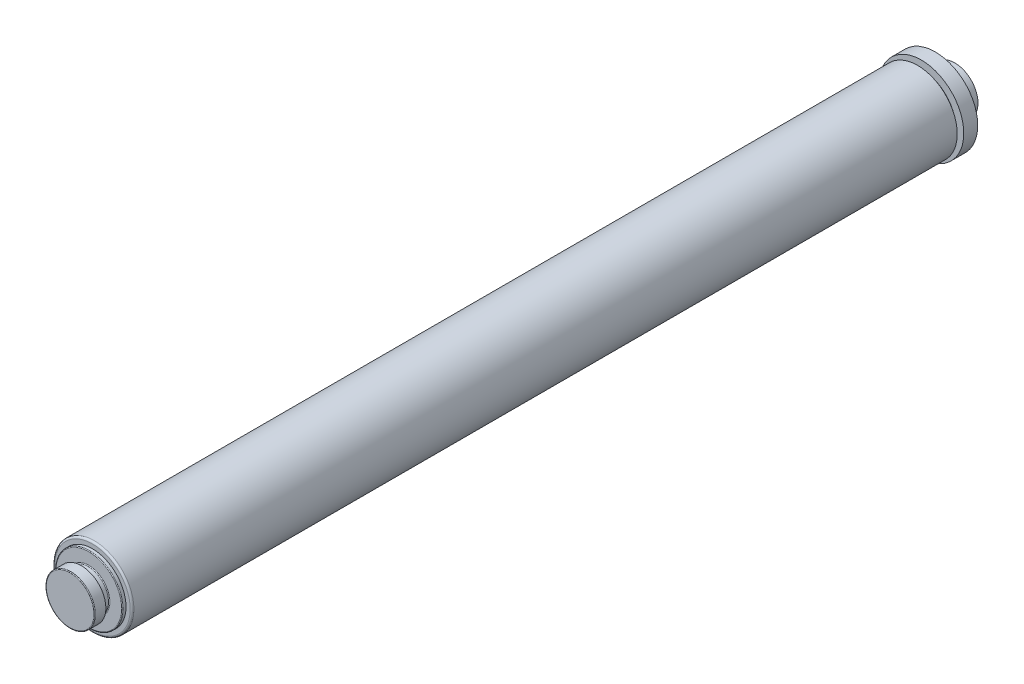
from build123d import *

# Parameters (mm, degrees)
SKETCH1_R           = 26.9875
BOSS_EXTRUDE1_DEPTH = 562.356
SKETCH2_R           = 22.86
BOSS_EXTRUDE2_DEPTH = 2.54
SKETCH3_R           = 13.915766971
BOSS_EXTRUDE3_DEPTH = 5.08
SKETCH4_R           = 16.731786723
BOSS_EXTRUDE4_DEPTH = 7.62
FILLET1_R           = 0.508
FILLET2_R           = 0.508
FILLET3_R           = 0.508
FILLET4_R           = 1.27
SKETCH5_R           = 23.627835933
BOSS_EXTRUDE5_DEPTH = 2.54
SKETCH6_R           = 28.8925
BOSS_EXTRUDE6_DEPTH = 9.525
SKETCH7_R           = 15.875
BOSS_EXTRUDE7_DEPTH = 13.208


with BuildPart() as part:
    # Sketch1 → Boss-Extrude1 (new body)
    with BuildSketch(Plane.XY):
        Circle(SKETCH1_R)
    extrude(amount=BOSS_EXTRUDE1_DEPTH)

    # Sketch2 → Boss-Extrude2 (add)
    with BuildSketch(Plane.XY.offset(562.356)):
        Circle(SKETCH2_R)
    extrude(amount=BOSS_EXTRUDE2_DEPTH)

    # Sketch3 → Boss-Extrude3 (add)
    with BuildSketch(Plane.XY.offset(564.896)):
        Circle(SKETCH3_R)
    extrude(amount=BOSS_EXTRUDE3_DEPTH)

    # Sketch4 → Boss-Extrude4 (add)
    with BuildSketch(Plane.XY.offset(569.976)):
        with Locations(Location((0, 0, 0), (0, 0, 180))):
            Circle(SKETCH4_R)
    extrude(amount=BOSS_EXTRUDE4_DEPTH)

    # Fillet1
    fillet1_edges = [part.edges().sort_by_distance(p)[0] for p in [
        (16.731786723, 0, 577.596),
    ]]
    fillet(fillet1_edges, radius=FILLET1_R)

    # Fillet2
    fillet2_edges = [part.edges().sort_by_distance(p)[0] for p in [
        (-13.915766971, 0, 564.896),
    ]]
    fillet(fillet2_edges, radius=FILLET2_R)

    # Fillet3
    fillet3_edges = [part.edges().sort_by_distance(p)[0] for p in [
        (-22.86, 0, 564.896),
    ]]
    fillet(fillet3_edges, radius=FILLET3_R)

    # Fillet4
    fillet4_edges = [part.edges().sort_by_distance(p)[0] for p in [
        (-26.9875, 0, 562.356),
    ]]
    fillet(fillet4_edges, radius=FILLET4_R)

    # Sketch5 → Boss-Extrude5 (add)
    with BuildSketch(Plane(origin=(0, 0, 0), x_dir=(-1, 0, 0), z_dir=(0, 0, -1))):
        Circle(SKETCH5_R)
    extrude(amount=BOSS_EXTRUDE5_DEPTH)

    # Sketch6 → Boss-Extrude6 (add)
    with BuildSketch(Plane(origin=(0, 0, -2.54), x_dir=(-1, 0, 0), z_dir=(0, 0, -1))):
        with Locations(Location((0, 0, 0), (0, 0, 180))):
            Circle(SKETCH6_R)
    extrude(amount=BOSS_EXTRUDE6_DEPTH)

    # Sketch7 → Boss-Extrude7 (add)
    with BuildSketch(Plane(origin=(0, 0, -12.065), x_dir=(-1, 0, 0), z_dir=(0, 0, -1))):
        with Locations(Location((0, 0, 0), (0, 0, 180))):
            Circle(SKETCH7_R)
    extrude(amount=BOSS_EXTRUDE7_DEPTH)


solid = part.part
